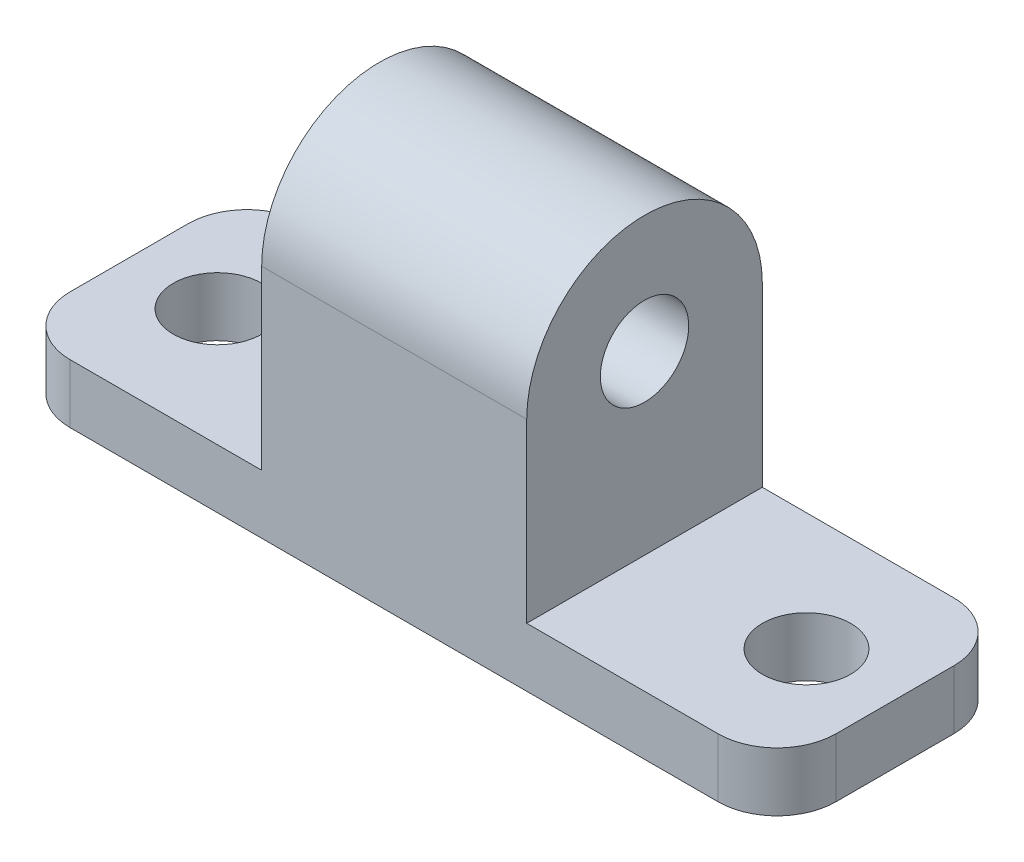
from build123d import *

# Parameters (mm, degrees)
SKETCH1_W           = 26
SKETCH1_H           = 12
BOSS_EXTRUDE1_DEPTH = 8
CUT_EXTRUDE1_DEPTH  = 28.856776554
SKETCH3_W           = 8.5
SKETCH3_H           = 10
CUT_EXTRUDE2_DEPTH  = 17.401219467
SKETCH4_R           = 1.5
CUT_EXTRUDE3_DEPTH  = 21.155644371
FILLET1_R           = 2
SKETCH5_R           = 1.5
CUT_EXTRUDE4_DEPTH  = 19.248287591


with BuildPart() as part:
    # Sketch1 → Boss-Extrude1 (new body)
    with BuildSketch(Plane.XY):
        Rectangle(SKETCH1_W, SKETCH1_H)
    extrude(amount=BOSS_EXTRUDE1_DEPTH)

    # Sketch2 → Cut-Extrude1 (cut, through all)
    with BuildSketch(Plane(origin=(13, 0, 0), x_dir=(0, 0, -1), z_dir=(1, 0, 0))):
        with BuildLine():
            Line((-8, 2), (-8, 7))
            Line((-8, 7), (0, 7))
            Line((0, 7), (0, 2))
            ThreePointArc((0, 2), (-4, 6), (-8, 2))
        make_face()
    extrude(amount=-CUT_EXTRUDE1_DEPTH, mode=Mode.SUBTRACT)

    # Sketch3 → Cut-Extrude2 (cut, through all)
    with BuildSketch(Plane.XY.offset(8)):
        with Locations((8.75, 1)):
            Rectangle(SKETCH3_W, SKETCH3_H)
        with Locations((-8.75, 1)):
            Rectangle(SKETCH3_W, SKETCH3_H)
    extrude(amount=-CUT_EXTRUDE2_DEPTH, mode=Mode.SUBTRACT)

    # Sketch4 → Cut-Extrude3 (cut, through all)
    with BuildSketch(Plane(origin=(4.5, 0, 0), x_dir=(0, 0, -1), z_dir=(1, 0, 0))):
        with Locations(Location((-4, 2, 0), (0, 0, 90))):
            Circle(SKETCH4_R)
    extrude(amount=-CUT_EXTRUDE3_DEPTH, mode=Mode.SUBTRACT)

    # Fillet1
    fillet1_edges = [part.edges().sort_by_distance(p)[0] for p in [
        (13, -5, 8),
        (13, -5, 0),
        (-13, -5, 8),
        (-13, -5, 0),
    ]]
    fillet(fillet1_edges, radius=FILLET1_R)

    # Sketch5 → Cut-Extrude4 (cut, through all)
    with BuildSketch(Plane(origin=(0, -4, 0), x_dir=(1, 0, 0), z_dir=(0, 1, 0))):
        with Locations(Location((-10, -4, 0), (0, 0, 180))):
            Circle(SKETCH5_R)
        with Locations(Location((10, -4, 0), (0, 0, 180))):
            Circle(SKETCH5_R)
    extrude(amount=-CUT_EXTRUDE4_DEPTH, mode=Mode.SUBTRACT)


solid = part.part
